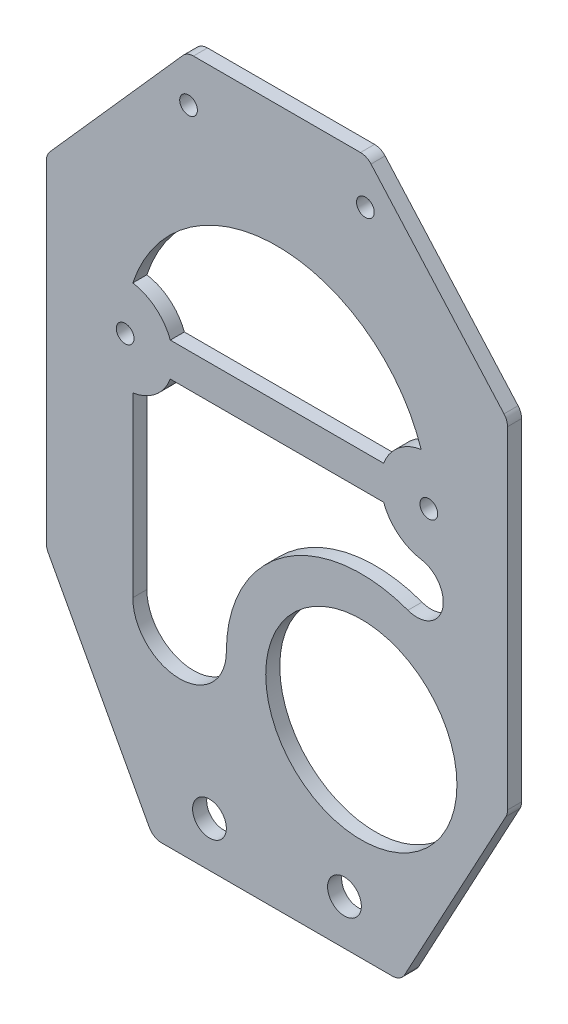
from build123d import *

# Parameters (mm, degrees)
SKETCH1_R           = 3.15
SKETCH1_R_2         = 34
BOSS_EXTRUDE2_DEPTH = 5
FILLET1_R           = 5
SKETCH2_R           = 6
CUT_EXTRUDE1_DEPTH  = 262.252751182


with BuildPart() as part:
    # Sketch1 → Boss-Extrude2 (new body)
    with BuildSketch(Plane.XY):
        Polygon((0, 0), (-44, 0), (-82, 70.398863627), (-82, 191.598863627), (-31.959298408, 248), (31.959298408, 248), (82, 191.598863627), (82, 70.398863627), (44, 0), align=None)
        with Locations((-31.449578633, 232)):
            Circle(SKETCH1_R, mode=Mode.SUBTRACT)
        with Locations((-24, 16)):
            Circle(SKETCH1_R, mode=Mode.SUBTRACT)
        with Locations((-54, 150.398863627)):
            Circle(SKETCH1_R, mode=Mode.SUBTRACT)
        with Locations(Location((24, 16, 0), (0, 0, 180))):
            Circle(SKETCH1_R, mode=Mode.SUBTRACT)
        with Locations(Location((31.449578633, 232, 0), (0, 0, 180))):
            Circle(SKETCH1_R, mode=Mode.SUBTRACT)
        with Locations(Location((54, 150.398863627, 0), (0, 0, 180))):
            Circle(SKETCH1_R, mode=Mode.SUBTRACT)
        with Locations((30, 70.398863627)):
            Circle(SKETCH1_R_2, mode=Mode.SUBTRACT)
        with BuildLine():
            Line((-37.93380879, 156.398863627), (37.93380879, 156.398863627))
            ThreePointArc((37.93380879, 156.398863627), (43.130728491, 163.664663146), (51.276643519, 167.331253579))
            ThreePointArc((51.276643519, 167.331253579), (0, 204.398863627), (-51.276643519, 167.331253579))
            ThreePointArc((-51.276643519, 167.331253579), (-43.130728491, 163.664663146), (-37.93380879, 156.398863627))
        make_face(mode=Mode.SUBTRACT)
        with BuildLine():
            Line((-51.276643519, 133.466473676), (-51.276643519, 70.398863627))
            ThreePointArc((-51.276643519, 70.398863627), (-34.638321759, 53.760541868), (-18, 70.398863627))
            ThreePointArc((-18, 70.398863627), (2.532150776, 109.762771703), (46.563219124, 115.450609123))
            ThreePointArc((46.563219124, 115.450609123), (58.841139814, 121.862892104), (51.276643519, 133.466473676))
            ThreePointArc((51.276643519, 133.466473676), (43.130728491, 137.133064108), (37.93380879, 144.398863627))
            Line((37.93380879, 144.398863627), (-37.93380879, 144.398863627))
            ThreePointArc((-37.93380879, 144.398863627), (-43.130728491, 137.133064108), (-51.276643519, 133.466473676))
        make_face(mode=Mode.SUBTRACT)
    extrude(amount=BOSS_EXTRUDE2_DEPTH)

    # Fillet1
    fillet1_edges = [part.edges().sort_by_distance(p)[0] for p in [
        (-44, 0, 2.5),
        (-82, 70.398863627, 2.5),
        (-82, 191.598863627, 2.5),
        (-31.959298408, 248, 2.5),
        (31.959298408, 248, 2.5),
        (82, 191.598863627, 2.5),
        (82, 70.398863627, 2.5),
        (44, 0, 2.5),
    ]]
    fillet(fillet1_edges, radius=FILLET1_R)

    # Sketch2 → Cut-Extrude1 (cut, through all)
    with BuildSketch(Plane(origin=(0, 0, 0), x_dir=(-1, 0, 0), z_dir=(0, 0, -1))):
        with Locations((24, 16)):
            Circle(SKETCH2_R)
        with Locations((-24, 16)):
            Circle(SKETCH2_R)
    extrude(amount=-CUT_EXTRUDE1_DEPTH, mode=Mode.SUBTRACT)


solid = part.part
